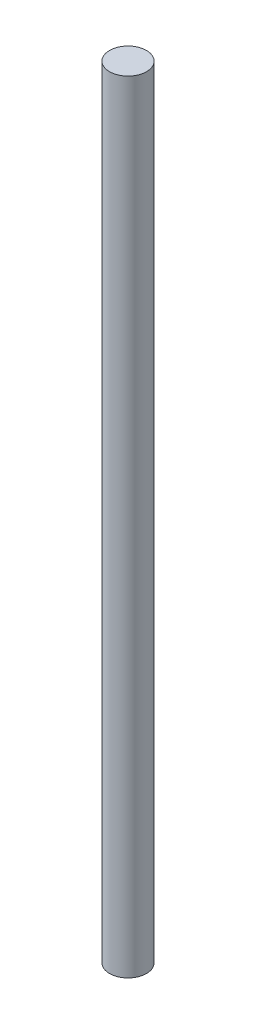
from build123d import *

# Parameters (mm, degrees)
SKETCH2_R           = 15
BOSS_EXTRUDE1_DEPTH = 635


with BuildPart() as part:
    # Sketch2 → Boss-Extrude1 (new body)
    with BuildSketch(Plane(origin=(0, 0, 0), x_dir=(1, 0, 0), z_dir=(0, 1, 0))):
        with Locations(Location((0, 0, 0), (0, 0, 90))):
            Circle(SKETCH2_R)
    extrude(amount=BOSS_EXTRUDE1_DEPTH)


solid = part.part
